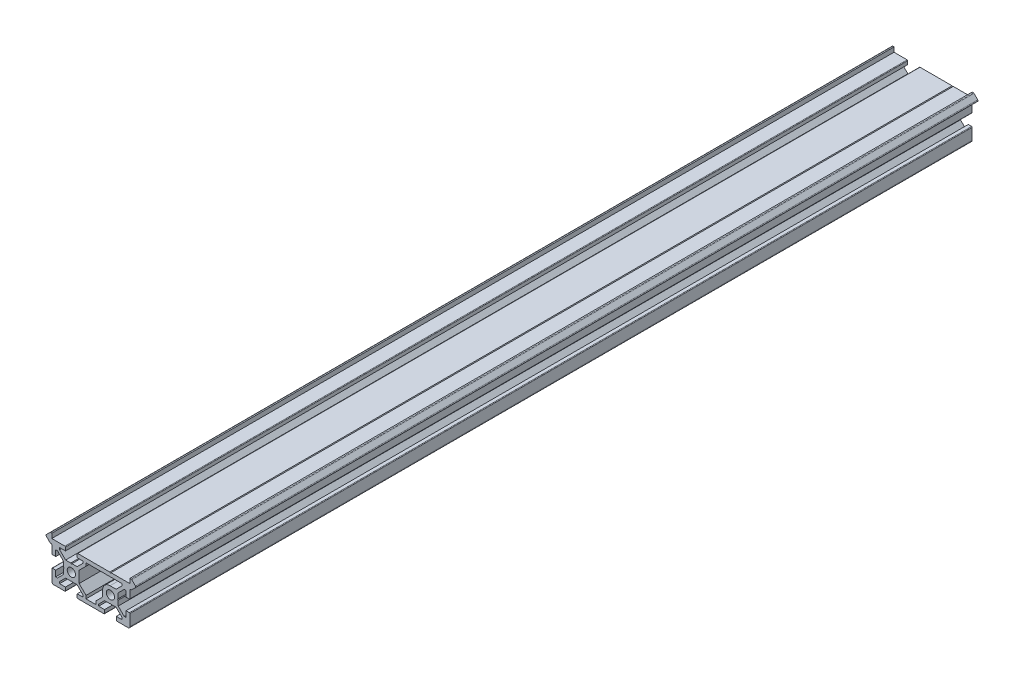
from build123d import *

# Parameters (mm, degrees)
MODEL_R             = 2.100000001
BOSS_EXTRUDE1_DEPTH = 431.1


with BuildPart() as part:
    # Model → Boss-Extrude1 (new body)
    with BuildSketch(Plane.XY):
        with BuildLine():
            Line((28.771485975, 48.105572105), (30.646485975, 49.980572105))
            ThreePointArc((30.646485975, 49.980572105), (30.808697649, 50.08895848), (31.000039365, 50.127018713))
            Line((31.000039365, 50.127018713), (31.592932584, 50.127018713))
            Line((31.592932584, 50.127018713), (31.592932584, 47.752018713))
            Line((31.592932584, 47.752018713), (38.292932585, 47.752018713))
            ThreePointArc((38.292932585, 47.752018713), (38.505064619, 47.664150748), (38.592932584, 47.452018714))
            Line((38.592932584, 47.452018714), (38.592932584, 45.752018713))
            Line((38.592932584, 45.752018713), (35.592932585, 45.752018713))
            Line((35.592932585, 45.752018713), (35.592932585, 44.812678885))
            Line((35.592932585, 44.812678885), (38.653592756, 41.752018713))
            Line((38.653592756, 41.752018713), (41.292932583, 41.752018713))
            Line((41.292932583, 41.752018713), (41.592932584, 41.452018713))
            Line((41.592932584, 41.452018713), (41.892932586, 41.752018714))
            Line((41.892932586, 41.752018714), (44.532272412, 41.752018714))
            Line((44.532272412, 41.752018714), (47.592932584, 44.812678886))
            Line((47.592932584, 44.812678886), (47.592932584, 45.752018714))
            Line((47.592932584, 45.752018714), (44.592932584, 45.752018714))
            Line((44.592932584, 45.752018714), (44.592932584, 47.452018715))
            ThreePointArc((44.592932584, 47.452018715), (44.68080055, 47.664150749), (44.892932584, 47.752018715))
            Line((44.892932584, 47.752018715), (61.292932583, 47.752018715))
            Line((61.292932583, 47.752018715), (61.592932582, 47.452018715))
            Line((61.592932582, 47.452018715), (61.892932583, 47.752018716))
            Line((61.892932583, 47.752018716), (71.592932583, 47.752018716))
            Line((71.592932583, 47.752018716), (71.592932583, 50.127018711))
            Line((71.592932583, 50.127018711), (72.185825802, 50.127018711))
            ThreePointArc((72.185825802, 50.127018711), (72.377167518, 50.088958477), (72.539379192, 49.980572102))
            Line((72.539379192, 49.980572102), (74.414379192, 48.105572102))
            ThreePointArc((74.414379192, 48.105572102), (74.560825801, 47.752018712), (74.414379192, 47.398465322))
            Line((74.414379192, 47.398465322), (72.539379192, 45.523465322))
            ThreePointArc((72.539379192, 45.523465322), (72.377167518, 45.415078947), (72.185825802, 45.377018714))
            Line((72.185825802, 45.377018714), (72.092932582, 45.377018714))
            ThreePointArc((72.092932582, 45.377018714), (71.739379192, 45.230572103), (71.592932583, 44.877018713))
            Line((71.592932583, 44.877018713), (71.592932583, 41.052018712))
            ThreePointArc((71.592932583, 41.052018712), (71.505064617, 40.839886678), (71.292932581, 40.752018713))
            Line((71.292932581, 40.752018713), (69.592932583, 40.752018713))
            Line((69.592932583, 40.752018713), (69.592932583, 43.752018712))
            Line((69.592932583, 43.752018712), (68.653592755, 43.752018712))
            Line((68.653592755, 43.752018712), (65.592932583, 40.691358541))
            Line((65.592932583, 40.691358541), (65.592932583, 38.052018712))
            Line((65.592932583, 38.052018712), (65.292932584, 37.752018712))
            Line((65.292932584, 37.752018712), (65.592932583, 37.452018713))
            Line((65.592932583, 37.452018713), (65.592932583, 34.812678884))
            Line((65.592932583, 34.812678884), (68.653592755, 31.752018712))
            Line((68.653592755, 31.752018712), (69.592932583, 31.752018712))
            Line((69.592932583, 31.752018712), (69.592932583, 34.752018711))
            Line((69.592932583, 34.752018711), (71.292932581, 34.752018711))
            ThreePointArc((71.292932581, 34.752018711), (71.505064617, 34.664150747), (71.592932583, 34.452018712))
            Line((71.592932583, 34.452018712), (71.592932583, 28.75201871))
            ThreePointArc((71.592932583, 28.75201871), (71.300039364, 28.044911929), (70.592932582, 27.752018711))
            Line((70.592932582, 27.752018711), (64.892932582, 27.752018711))
            ThreePointArc((64.892932582, 27.752018711), (64.680800548, 27.839886676), (64.592932583, 28.05201871))
            Line((64.592932583, 28.05201871), (64.592932583, 29.752018711))
            Line((64.592932583, 29.752018711), (67.592932582, 29.752018711))
            Line((67.592932582, 29.752018711), (67.592932582, 30.69135854))
            Line((67.592932582, 30.69135854), (64.532272411, 33.752018711))
            Line((64.532272411, 33.752018711), (61.892932584, 33.752018711))
            Line((61.892932584, 33.752018711), (61.592932582, 34.052018713))
            Line((61.592932582, 34.052018713), (61.292932582, 33.752018712))
            Line((61.292932582, 33.752018712), (58.653592755, 33.752018712))
            Line((58.653592755, 33.752018712), (55.592932583, 30.691358541))
            Line((55.592932583, 30.691358541), (55.592932583, 29.752018713))
            Line((55.592932583, 29.752018713), (58.592932583, 29.752018713))
            Line((58.592932583, 29.752018713), (58.592932583, 28.052018712))
            ThreePointArc((58.592932583, 28.052018712), (58.505064617, 27.839886678), (58.292932583, 27.752018712))
            Line((58.292932583, 27.752018712), (44.892932584, 27.752018712))
            ThreePointArc((44.892932584, 27.752018712), (44.68080055, 27.839886678), (44.592932584, 28.052018712))
            Line((44.592932584, 28.052018712), (44.592932584, 29.752018713))
            Line((44.592932584, 29.752018713), (47.592932584, 29.752018713))
            Line((47.592932584, 29.752018713), (47.592932584, 30.691358541))
            Line((47.592932584, 30.691358541), (44.532272412, 33.752018712))
            Line((44.532272412, 33.752018712), (41.892932586, 33.752018712))
            Line((41.892932586, 33.752018712), (41.592932584, 34.052018714))
            Line((41.592932584, 34.052018714), (41.292932583, 33.752018714))
            Line((41.292932583, 33.752018714), (38.653592756, 33.752018714))
            Line((38.653592756, 33.752018714), (35.592932585, 30.691358542))
            Line((35.592932585, 30.691358542), (35.592932585, 29.752018714))
            Line((35.592932585, 29.752018714), (38.592932584, 29.752018714))
            Line((38.592932584, 29.752018714), (38.592932584, 28.052018713))
            ThreePointArc((38.592932584, 28.052018713), (38.505064619, 27.839886679), (38.292932585, 27.752018714))
            Line((38.292932585, 27.752018714), (32.592932585, 27.752018714))
            ThreePointArc((32.592932585, 27.752018714), (31.885825803, 28.044911931), (31.592932584, 28.752018713))
            Line((31.592932584, 28.752018713), (31.592932584, 34.452018715))
            ThreePointArc((31.592932584, 34.452018715), (31.68080055, 34.664150748), (31.892932583, 34.752018714))
            Line((31.892932583, 34.752018714), (33.592932584, 34.752018714))
            Line((33.592932584, 34.752018714), (33.592932584, 31.752018715))
            Line((33.592932584, 31.752018715), (34.532272412, 31.752018715))
            Line((34.532272412, 31.752018715), (37.592932584, 34.812678886))
            Line((37.592932584, 34.812678886), (37.592932584, 37.452018715))
            Line((37.592932584, 37.452018715), (37.892932583, 37.752018715))
            Line((37.892932583, 37.752018715), (37.592932584, 38.052018714))
            Line((37.592932584, 38.052018714), (37.592932584, 40.691358543))
            Line((37.592932584, 40.691358543), (34.532272412, 43.752018715))
            Line((34.532272412, 43.752018715), (33.592932584, 43.752018715))
            Line((33.592932584, 43.752018715), (33.592932584, 40.752018716))
            Line((33.592932584, 40.752018716), (31.892932586, 40.752018716))
            ThreePointArc((31.892932586, 40.752018716), (31.68080055, 40.83988668), (31.592932584, 41.052018715))
            Line((31.592932584, 41.052018715), (31.592932584, 44.877018715))
            ThreePointArc((31.592932584, 44.877018715), (31.446485975, 45.230572106), (31.092932585, 45.377018716))
            Line((31.092932585, 45.377018716), (31.000039365, 45.377018716))
            ThreePointArc((31.000039365, 45.377018716), (30.808697649, 45.41507895), (30.646485975, 45.523465324))
            Line((30.646485975, 45.523465324), (28.771485975, 47.398465325))
            ThreePointArc((28.771485975, 47.398465325), (28.625039366, 47.752018715), (28.771485975, 48.105572105))
        make_face()
        with Locations((61.592932582, 37.752018715)):
            Circle(MODEL_R, mode=Mode.SUBTRACT)
        with Locations((41.592932582, 37.752018715)):
            Circle(MODEL_R, mode=Mode.SUBTRACT)
        with BuildLine():
            Line((54.092932584, 29.752018715), (49.092932584, 29.752018715))
            Line((49.092932584, 29.752018715), (49.092932584, 31.312678886))
            Line((49.092932584, 31.312678886), (45.592932583, 34.812678886))
            Line((45.592932583, 34.812678886), (45.592932583, 40.691358543))
            Line((45.592932583, 40.691358543), (49.092932584, 44.191358544))
            Line((49.092932584, 44.191358544), (49.092932584, 45.752018714))
            Line((49.092932584, 45.752018714), (67.592932582, 45.752018714))
            Line((67.592932582, 45.752018714), (67.592932582, 44.812678887))
            Line((67.592932582, 44.812678887), (64.532272411, 41.752018716))
            Line((64.532272411, 41.752018716), (61.402932584, 41.752018716))
            ThreePointArc((61.402932584, 41.752018716), (58.708855747, 40.636095552), (57.592932584, 37.942018716))
            Line((57.592932584, 37.942018716), (57.592932584, 34.812678886))
            Line((57.592932584, 34.812678886), (54.092932584, 31.312678886))
            Line((54.092932584, 31.312678886), (54.092932584, 29.752018715))
        make_face(mode=Mode.SUBTRACT)
    extrude(amount=-BOSS_EXTRUDE1_DEPTH)


solid = part.part
